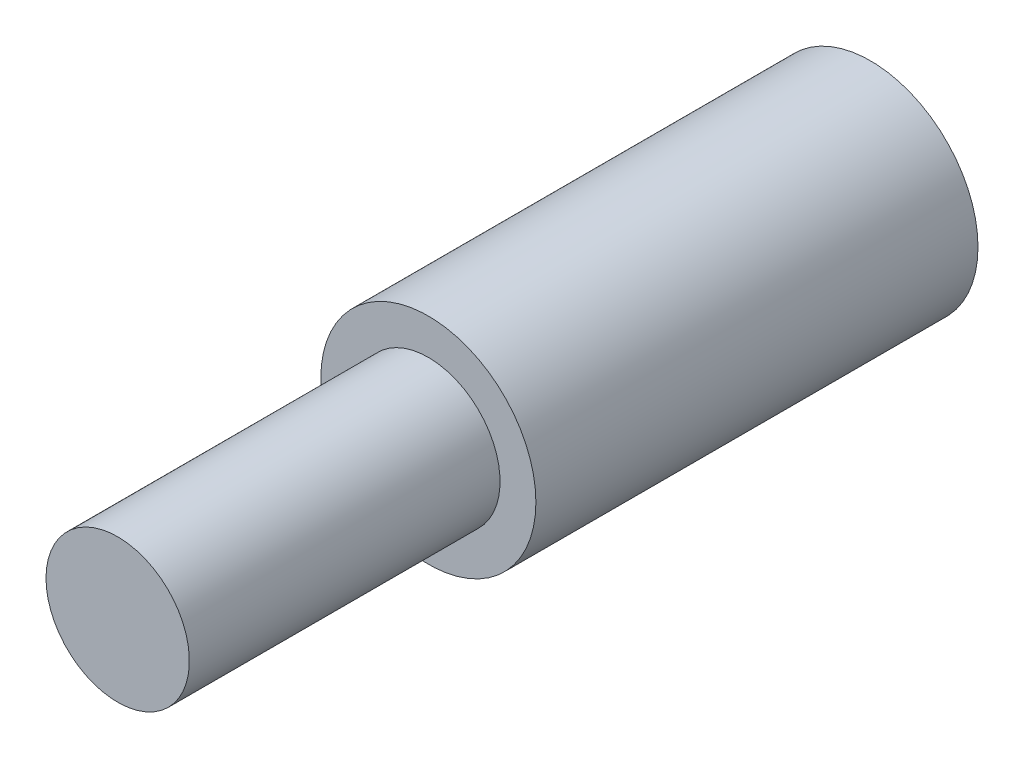
from build123d import *

# Parameters (mm, degrees)
CROQUIS1_R              = 9
SALIENTE_EXTRUIR1_DEPTH = 37
CROQUIS2_R              = 6
SALIENTE_EXTRUIR2_DEPTH = 26


with BuildPart() as part:
    # Croquis1 → Saliente-Extruir1 (new body)
    with BuildSketch(Plane.XY):
        Circle(CROQUIS1_R)
    extrude(amount=SALIENTE_EXTRUIR1_DEPTH)

    # Croquis2 → Saliente-Extruir2 (add)
    with BuildSketch(Plane.XY.offset(37)):
        with Locations(Location((0, 0, 0), (0, 0, 180))):
            Circle(CROQUIS2_R)
    extrude(amount=SALIENTE_EXTRUIR2_DEPTH)


solid = part.part
